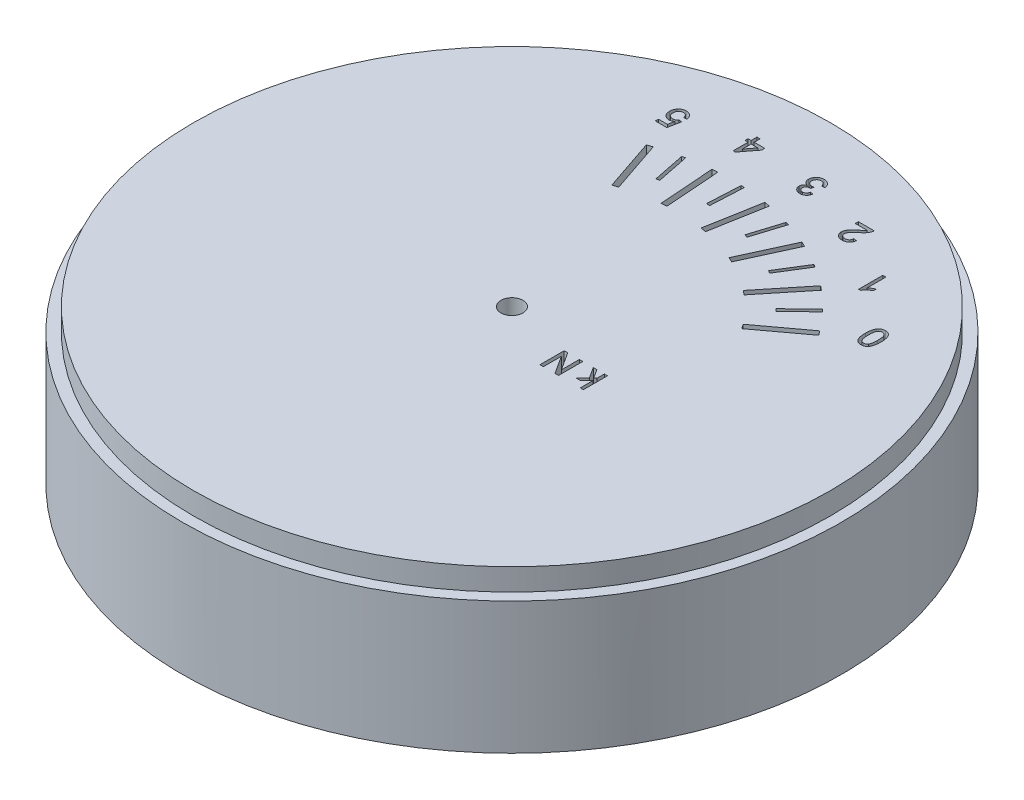
from build123d import *

# Parameters (mm, degrees)
SKETCH1_R           = 30
DIAL_CASE_DEPTH     = 12
SKETCH5_R           = 29
BEZEL_SPIGOT_DEPTH  = 2
SKETCH14_R          = 1
CUT_EXTRUDE8_DEPTH  = 14
SKETCH15_R          = 7.5
CUT_EXTRUDE9_DEPTH  = 6
CIRPATTERN1_COUNT   = 3
SKETCH20_W          = 7
SKETCH20_H          = 49.580398915
CUT_EXTRUDE11_DEPTH = 6
CUT_EXTRUDE27_DEPTH = 2


with BuildPart() as part:
    # Sketch1 → DIAL_CASE (new body)
    with BuildSketch(Plane(origin=(0, 0, 0), x_dir=(1, 0, 0), z_dir=(0, 1, 0))):
        with Locations(Location((0, 0, 0), (0, 0, 270))):
            Circle(SKETCH1_R)
    extrude(amount=DIAL_CASE_DEPTH)

    # Sketch5 → BEZEL_SPIGOT (add)
    with BuildSketch(Plane(origin=(0, 12, 0), x_dir=(1, 0, 0), z_dir=(0, 1, 0))):
        with Locations(Location((0, 0, 0), (0, 0, 270))):
            Circle(SKETCH5_R)
    extrude(amount=BEZEL_SPIGOT_DEPTH)

    # Sketch14 → Cut-Extrude8 (cut)
    with BuildSketch(Plane(origin=(0, 14, 0), x_dir=(1, 0, 0), z_dir=(0, 1, 0))):
        with Locations(Location((0, 0, 0), (0, 0, 270))):
            Circle(SKETCH14_R)
    extrude(amount=-CUT_EXTRUDE8_DEPTH, mode=Mode.SUBTRACT)

    # Sketch15 → Cut-Extrude9 (cut)
    with BuildSketch(Plane.XZ):
        with Locations(Location((0, 0, 0), (0, 0, 90))):
            Circle(SKETCH15_R)
    extrude(amount=-CUT_EXTRUDE9_DEPTH, mode=Mode.SUBTRACT)

    # Sketch19 → CSK for M3 SFHCS1 (revolve, cut)
    with BuildSketch(Plane(origin=(0, 0, 20), x_dir=(0, 0, -1), z_dir=(1, 0, 0))):
        Polygon((0, 0), (0, 7.021463052), (1.7, 6), (1.7, 1.66), (3.36, 0), align=None)
    csk_for_m3_sfhcs1 = revolve(axis=Axis((0, -6.35, 20), (0, 1, 0)), mode=Mode.SUBTRACT)

    # CirPattern1: CSK for M3 SFHCS1 ×3 about axis
    cirpattern1_axis = Axis((0, 0, 0), (0, 1, 0))
    for i in range(1, CIRPATTERN1_COUNT):
        add(csk_for_m3_sfhcs1.rotate(cirpattern1_axis, i * 360 / CIRPATTERN1_COUNT), mode=Mode.SUBTRACT)

    # Sketch20 → Cut-Extrude11 (cut)
    with BuildSketch(Plane(origin=(0, 0, 0), x_dir=(-1, 0, 0), z_dir=(0, -1, 0))):
        with Locations((-8.5, 4.790199458)):
            Rectangle(SKETCH20_W, SKETCH20_H)
    extrude(amount=-CUT_EXTRUDE11_DEPTH, mode=Mode.SUBTRACT)

    # Sketch43 → Cut-Extrude27 (cut)
    # profile 1 of 19: a face of its own
    with BuildSketch(Plane(origin=(0, 12, 0), x_dir=(1, 0, 0), z_dir=(0, 1, 0))):
        Polygon((11.904206737, 9.129751474), (12.201835663, 8.7279841), (16.219509396, 11.704273363), (15.92188047, 12.106040736), align=None)
    # profile 2 of 19: a face of its own
    with BuildSketch(Plane(origin=(0, 12, 0), x_dir=(1, 0, 0), z_dir=(0, 1, 0))):
        Polygon((9.254243085, 11.807687535), (9.642583551, 11.492740424), (12.792054657, 15.376145084), (12.403714191, 15.691092195), align=None)
    # profile 3 of 19: a face of its own
    with BuildSketch(Plane(origin=(0, 12, 0), x_dir=(1, 0, 0), z_dir=(0, 1, 0))):
        Polygon((6.020657208, 13.740967462), (6.47521838, 13.532702869), (8.557864311, 18.07831459), (8.103303139, 18.286579184), align=None)
    # profile 4 of 19: a face of its own
    with BuildSketch(Plane(origin=(0, 12, 0), x_dir=(1, 0, 0), z_dir=(0, 1, 0))):
        Polygon((2.407376381, 14.807668249), (2.899491193, 14.719220456), (3.783969122, 19.640368573), (3.29185431, 19.728816366), align=None)
    # profile 5 of 19: a face of its own
    with BuildSketch(Plane(origin=(0, 12, 0), x_dir=(1, 0, 0), z_dir=(0, 1, 0))):
        Polygon((-1.357726518, 14.94051802), (-0.859093467, 14.97746502), (-1.228563465, 19.963795526), (-1.727196515, 19.926848526), align=None)
    # profile 6 of 19: a face of its own
    with BuildSketch(Plane(origin=(0, 12, 0), x_dir=(1, 0, 0), z_dir=(0, 1, 0))):
        Polygon((-5.037203897, 14.131138556), (-4.563499083, 14.291150273), (-6.163616247, 19.028198411), (-6.637321061, 18.868186694), align=None)
    # profile 7 of 19: a face of its own
    with BuildSketch(Plane(origin=(0, 12, 0), x_dir=(1, 0, 0), z_dir=(0, 1, 0))):
        Polygon((12.177630557, 11.862875453), (12.385063097, 11.646145803), (14.552359596, 13.720471208), (14.344927056, 13.937200858), align=None)
    # profile 8 of 19: a face of its own
    with BuildSketch(Plane(origin=(0, 12, 0), x_dir=(1, 0, 0), z_dir=(0, 1, 0))):
        Polygon((8.838112877, 14.522749767), (9.093000675, 14.364534059), (10.675157753, 16.913412043), (10.420269955, 17.071627751), align=None)
    # profile 9 of 19: a face of its own
    with BuildSketch(Plane(origin=(0, 12, 0), x_dir=(1, 0, 0), z_dir=(0, 1, 0))):
        Polygon((4.941216374, 16.266741553), (5.227484838, 16.177017719), (6.12472318, 19.03970236), (5.838454716, 19.129426194), align=None)
    # profile 10 of 19: a face of its own
    with BuildSketch(Plane(origin=(0, 12, 0), x_dir=(1, 0, 0), z_dir=(0, 1, 0))):
        Polygon((0.732700253, 16.984865332), (1.032295758, 16.969291838), (1.1880307, 19.965246882), (0.888435195, 19.980820376), align=None)
    # profile 11 of 19: a face of its own
    with BuildSketch(Plane(origin=(0, 12, 0), x_dir=(1, 0, 0), z_dir=(0, 1, 0))):
        Polygon((-3.522023877, 16.631832365), (-3.227995432, 16.691391359), (-3.823585372, 19.631675805), (-4.117613816, 19.572116811), align=None)
    # profile 12 of 19: a face of its own
    with BuildSketch(Plane(origin=(0, 12, 0), x_dir=(1, 0, 0), z_dir=(0, 1, 0))):
        with BuildLine():
            add(Edge.make_bspline(
                [(19.588194751, 13.989440943), (19.587910508, 13.958000939), (19.587353794, 13.89642321), (19.583902691, 13.806323677), (19.577871681, 13.720760822), (19.568887763, 13.639804704), (19.558168373, 13.563144327), (19.544436382, 13.49098399), (19.528765941, 13.42324263), (19.510191242, 13.360177347), (19.489439178, 13.301133808), (19.466289506, 13.245945846), (19.439927647, 13.194895358), (19.412579294, 13.146767036), (19.381463663, 13.103407546), (19.348766206, 13.063242025), (19.313491266, 13.026968124), (19.275487559, 12.994761303), (19.235049694, 12.966327767), (19.192304993, 12.94165046), (19.146945317, 12.920631312), (19.098842724, 12.904164221), (19.048465422, 12.890910413), (18.995614062, 12.881112697), (18.940194422, 12.875348095), (18.902324297, 12.874757367), (18.883066546, 12.874456969)],
                knots=[0, 0, 0, 0, 1.514548985, 2.966363668, 4.342801279, 5.645536807, 6.88951609, 8.070636169, 9.18292944, 10.237633186, 11.23586543, 12.196673567, 13.117642805, 14.002448775, 14.860474521, 15.685016546, 16.495716207, 17.293997176, 18.081286888, 18.873901753, 19.668661895, 20.485546082, 21.319749152, 22.176139114, 23.072528574, 24, 24, 24, 24], degree=3))
            add(Edge.make_bspline(
                [(18.883066546, 12.874456969), (18.854809121, 12.875274628), (18.799296277, 12.876880952), (18.718349937, 12.890367128), (18.641827842, 12.9124468), (18.570310234, 12.943174302), (18.504739034, 12.982537638), (18.445935132, 13.029838471), (18.395318794, 13.085781836), (18.351889885, 13.149224706), (18.314616703, 13.22014777), (18.281284051, 13.297942796), (18.251395367, 13.382922338), (18.229518855, 13.458776472), (18.214181325, 13.524367131), (18.204843427, 13.578566772), (18.196221835, 13.636868938), (18.190110735, 13.699413261), (18.183892193, 13.765907419), (18.180822023, 13.836641357), (18.17847903, 13.911567043), (18.178121949, 13.962996348), (18.177938341, 13.989440943)],
                knots=[0, 0, 0, 0, 1.134392726, 2.228560011, 3.285421824, 4.326686528, 5.345663051, 6.348245061, 7.346442277, 8.364444627, 9.428234171, 10.559369172, 11.76117748, 13.044149777, 13.72830454, 14.465558531, 15.252424724, 16.094928615, 16.989169351, 17.934396366, 18.93788079, 20, 20, 20, 20], degree=3))
            add(Edge.make_bspline(
                [(18.177938341, 13.989440943), (18.178226252, 14.020733526), (18.178788741, 14.081869747), (18.182170352, 14.171243265), (18.188483548, 14.25617315), (18.196613619, 14.336764445), (18.207578689, 14.413086775), (18.221192935, 14.48483049), (18.237122696, 14.552166703), (18.255035112, 14.615365913), (18.275699736, 14.67456731), (18.299114958, 14.729695619), (18.324677105, 14.781177736), (18.35282256, 14.82875241), (18.383405925, 14.872576799), (18.415933253, 14.91294251), (18.451308912, 14.949288413), (18.489461309, 14.981430065), (18.529623749, 15.010388115), (18.572602896, 15.035159869), (18.618298941, 15.055825647), (18.666304423, 15.073097892), (18.71693803, 15.086224439), (18.769935925, 15.095970551), (18.825643873, 15.10179179), (18.863661568, 15.102367992), (18.883066546, 15.102662097)],
                knots=[0, 0, 0, 0, 1.508950488, 2.948031798, 4.311688408, 5.614950163, 6.853137481, 8.028455569, 9.134944892, 10.188708076, 11.194600246, 12.156350049, 13.075032267, 13.964295672, 14.819092354, 15.649926205, 16.461420415, 17.260483761, 18.05264124, 18.846032929, 19.648010917, 20.468054852, 21.303075505, 22.167271292, 23.064539283, 24, 24, 24, 24], degree=3))
            add(Edge.make_bspline(
                [(18.883066546, 15.102662097), (18.908508152, 15.101936374), (18.958112279, 15.100521414), (19.030555451, 15.09090763), (19.098547231, 15.073986918), (19.162661092, 15.051293858), (19.222176377, 15.020940583), (19.277377246, 14.984009897), (19.329372923, 14.941361032), (19.359304796, 14.907712056), (19.374452764, 14.890682931)],
                knots=[0, 0, 0, 0, 1.10322584, 2.150986741, 3.161425019, 4.136713905, 5.093944212, 6.049774532, 7.013026876, 8, 8, 8, 8], degree=3))
            add(Edge.make_bspline(
                [(19.374452764, 14.890682931), (19.391888424, 14.865531735), (19.427841502, 14.813668893), (19.469921461, 14.725237938), (19.507457531, 14.627887871), (19.536916463, 14.519708697), (19.55999015, 14.4015614), (19.576655113, 14.273214149), (19.586085842, 14.134722395), (19.587475912, 14.038961309), (19.588194751, 13.989440943)],
                knots=[0, 0, 0, 0, 0.779365345, 1.607084704, 2.489375761, 3.438383567, 4.461919411, 5.557722155, 6.737039282, 8, 8, 8, 8], degree=3))
        make_face()
        with BuildLine():
            add(Edge.make_bspline(
                [(19.306143469, 13.988559533), (19.305863415, 14.030873535), (19.305327329, 14.111871894), (19.299726529, 14.227592025), (19.290084982, 14.331987378), (19.277338227, 14.424913413), (19.260507351, 14.506495829), (19.239374194, 14.57652673), (19.2155521, 14.635846645), (19.18607271, 14.68372035), (19.153796035, 14.722744403), (19.120472573, 14.75630635), (19.085318339, 14.784833237), (19.04856271, 14.808618843), (19.009635397, 14.826627742), (18.968962062, 14.839680631), (18.926533856, 14.847192369), (18.897638319, 14.848271664), (18.883066546, 14.848815943)],
                knots=[0, 0, 0, 0, 1.89448813, 3.626469325, 5.185477471, 6.587276848, 7.82441448, 8.910550357, 9.859733512, 10.6775885, 11.416198291, 12.123144072, 12.791880183, 13.439617036, 14.078171869, 14.70637855, 15.347637704, 16, 16, 16, 16], degree=3))
            add(Edge.make_bspline(
                [(18.883066546, 14.848815943), (18.868498304, 14.848259915), (18.839609769, 14.84715732), (18.797085252, 14.839809134), (18.756563724, 14.826092107), (18.717718826, 14.808117251), (18.680523736, 14.784937521), (18.645851192, 14.755780037), (18.612154223, 14.722319983), (18.580221687, 14.682850203), (18.550547709, 14.634993504), (18.526770618, 14.575635913), (18.505618407, 14.505617973), (18.488842574, 14.424171247), (18.476005164, 14.331406135), (18.466433931, 14.227295907), (18.460791966, 14.111726025), (18.460265271, 14.030873831), (18.459989623, 13.988559533)],
                knots=[0, 0, 0, 0, 0.652578524, 1.294050225, 1.924494109, 2.563260593, 3.207694917, 3.880813851, 4.587993952, 5.331957758, 6.150083828, 7.099581593, 8.186077474, 9.42362516, 10.819375359, 12.378900244, 14.104883934, 16, 16, 16, 16], degree=3))
            add(Edge.make_bspline(
                [(18.459989623, 13.988559533), (18.460256717, 13.947125758), (18.46076846, 13.867740214), (18.466552205, 13.754249479), (18.475615638, 13.651606212), (18.488013642, 13.559716592), (18.504488492, 13.47867782), (18.524476574, 13.408325348), (18.548275961, 13.348784655), (18.576633103, 13.299533489), (18.608074588, 13.25887828), (18.641480362, 13.224373932), (18.67620395, 13.194136614), (18.714229663, 13.170460171), (18.753940969, 13.151042072), (18.796189153, 13.138042966), (18.840428702, 13.129700239), (18.870687639, 13.12877564), (18.886151482, 13.128303123)],
                knots=[0, 0, 0, 0, 1.850145643, 3.544809038, 5.072983816, 6.450691362, 7.683229814, 8.76276662, 9.712991103, 10.538891656, 11.292051756, 12.001912283, 12.681449089, 13.342071824, 13.996410874, 14.649960216, 15.310061595, 16, 16, 16, 16], degree=3))
            add(Edge.make_bspline(
                [(18.886151482, 13.128303123), (18.900724217, 13.128681569), (18.929459782, 13.129427816), (18.971500063, 13.136682818), (19.011522536, 13.14852633), (19.049260849, 13.165610934), (19.085088552, 13.186806065), (19.11904912, 13.212585719), (19.150328311, 13.243743208), (19.169153032, 13.267086763), (19.178779687, 13.279024277)],
                knots=[0, 0, 0, 0, 1.021462953, 2.014194051, 2.982449609, 3.941891643, 4.91211921, 5.897280499, 6.924703483, 8, 8, 8, 8], degree=3))
            add(Edge.make_bspline(
                [(19.178779687, 13.279024277), (19.189263134, 13.296550691), (19.211401967, 13.333562788), (19.236164806, 13.397893332), (19.258124512, 13.471539124), (19.275960128, 13.555408639), (19.289157683, 13.649386697), (19.299379117, 13.753323416), (19.304740126, 13.867603448), (19.305662782, 13.947128433), (19.306143469, 13.988559533)],
                knots=[0, 0, 0, 0, 0.671109831, 1.417242661, 2.260125669, 3.199948126, 4.23589883, 5.382398214, 6.636276086, 8, 8, 8, 8], degree=3))
        make_face(mode=Mode.SUBTRACT)
    # profile 13 of 19: a face of its own
    with BuildSketch(Plane(origin=(0, 12, 0), x_dir=(1, 0, 0), z_dir=(0, 1, 0))):
        with BuildLine():
            Line((14.407642404, 19.352001901), (14.689693686, 19.352001901))
            Line((14.689693686, 19.352001901), (14.689693686, 17.637658953))
            add(Edge.make_bspline(
                [(14.689693686, 17.637658953), (14.705939906, 17.653313064), (14.739705895, 17.68584842), (14.79659993, 17.731996926), (14.860522228, 17.778000197), (14.929704418, 17.823324057), (15.000555464, 17.865721374), (15.069185162, 17.90381391), (15.134102796, 17.935987754), (15.176866065, 17.953577499), (15.197385993, 17.962017927)],
                knots=[0, 0, 0, 0, 0.893397159, 1.856828087, 2.898636849, 4.012322965, 5.13208925, 6.168716716, 7.121259871, 8, 8, 8, 8], degree=3))
            Line((15.197385993, 17.962017927), (15.197385993, 17.702001901))
            add(Edge.make_bspline(
                [(15.197385993, 17.702001901), (15.162148049, 17.68384139), (15.092696146, 17.648048099), (14.994382794, 17.586347454), (14.903061577, 17.518812635), (14.819275234, 17.446755065), (14.744555984, 17.372946524), (14.681096324, 17.298936225), (14.628414659, 17.226583843), (14.601893545, 17.176127), (14.589212916, 17.152001901)],
                knots=[0, 0, 0, 0, 1.141359047, 2.249551097, 3.338622382, 4.409719606, 5.42990334, 6.36011437, 7.215916014, 8, 8, 8, 8], degree=3))
            Line((14.589212916, 17.152001901), (14.407642404, 17.152001901))
            Line((14.407642404, 17.152001901), (14.407642404, 19.352001901))
        make_face()
    # profile 14 of 19: a face of its own
    with BuildSketch(Plane(origin=(0, 12, 0), x_dir=(1, 0, 0), z_dir=(0, 1, 0))):
        with BuildLine():
            Line((9.069146677, 22.18232381), (9.069146677, 22.464375092))
            Line((9.069146677, 22.464375092), (10.507608216, 22.464375092))
            add(Edge.make_bspline(
                [(10.507608216, 22.464375092), (10.507647327, 22.447610791), (10.507725077, 22.414284583), (10.501944288, 22.364802772), (10.493232714, 22.3159316), (10.483141353, 22.284475757), (10.478080972, 22.268702015)],
                knots=[0, 0, 0, 0, 1.010600758, 2.009000657, 3.001600101, 4, 4, 4, 4], degree=3))
            add(Edge.make_bspline(
                [(10.478080972, 22.268702015), (10.468764001, 22.242919337), (10.449837831, 22.19054531), (10.411061099, 22.114872022), (10.365575116, 22.039655585), (10.321460015, 21.978136377), (10.281008362, 21.929368822), (10.247635052, 21.890762576), (10.210045364, 21.851737132), (10.168919058, 21.811599859), (10.124507327, 21.770347497), (10.076811432, 21.727788083), (10.02525019, 21.684730468), (9.989255791, 21.656189463), (9.97082937, 21.641578618)],
                knots=[0, 0, 0, 0, 1.204775845, 2.447339333, 3.731688634, 5.069474332, 5.771881205, 6.518320379, 7.313534551, 8.154278236, 9.045805008, 9.979490009, 10.965651065, 12, 12, 12, 12], degree=3))
            add(Edge.make_bspline(
                [(9.97082937, 21.641578618), (9.942521739, 21.617752541), (9.888013602, 21.571873919), (9.811039527, 21.503794322), (9.74073639, 21.44057847), (9.678223032, 21.381118767), (9.62299029, 21.325990677), (9.574901696, 21.27532311), (9.533564773, 21.229261612), (9.499418266, 21.186178312), (9.470834286, 21.145504419), (9.446017142, 21.106049247), (9.42609474, 21.066431241), (9.408998325, 21.027402779), (9.395734769, 20.988809733), (9.386400228, 20.950306425), (9.380368261, 20.912257335), (9.379721233, 20.88681906), (9.379403088, 20.87431099)],
                knots=[0, 0, 0, 0, 1.782511555, 3.432339066, 4.950556168, 6.337242158, 7.588364383, 8.709771971, 9.70247892, 10.569050646, 11.3564271, 12.096888545, 12.812232926, 13.490631961, 14.148641375, 14.7751826, 15.397753892, 16, 16, 16, 16], degree=3))
            add(Edge.make_bspline(
                [(9.379403088, 20.87431099), (9.379709292, 20.861946817), (9.380310047, 20.837688984), (9.38601117, 20.802188289), (9.393944993, 20.767998371), (9.40678154, 20.735743649), (9.422026655, 20.70443543), (9.441779363, 20.675093893), (9.464137809, 20.646609884), (9.490257881, 20.620475219), (9.518588325, 20.595981723), (9.5501215, 20.575514129), (9.583374975, 20.557653394), (9.618637454, 20.543095441), (9.65617424, 20.532021338), (9.695721462, 20.524263833), (9.737423346, 20.519259909), (9.765886861, 20.518572716), (9.780444754, 20.518221246)],
                knots=[0, 0, 0, 0, 0.987999173, 1.938400644, 2.870175051, 3.788745887, 4.708217872, 5.649938364, 6.61138593, 7.600013579, 8.600369295, 9.600725011, 10.599354487, 11.616065131, 12.645726306, 13.724038792, 14.835941382, 16, 16, 16, 16], degree=3))
            add(Edge.make_bspline(
                [(9.780444754, 20.518221246), (9.795736554, 20.51857333), (9.82566373, 20.519262385), (9.869416239, 20.524253075), (9.910925402, 20.531941565), (9.950082087, 20.543432939), (9.986606304, 20.558674728), (10.021328511, 20.576045194), (10.053326805, 20.597502787), (10.082638515, 20.622239739), (10.109769776, 20.649241048), (10.132673679, 20.679765469), (10.152849351, 20.712289408), (10.168419625, 20.747935104), (10.181438381, 20.785588394), (10.190718445, 20.825895408), (10.19581034, 20.868746965), (10.196830526, 20.898096468), (10.197351806, 20.913093041)],
                knots=[0, 0, 0, 0, 1.131007971, 2.213465715, 3.25352735, 4.250693176, 5.225400803, 6.177988609, 7.118348849, 8.067272485, 9.012455277, 9.942714685, 10.883890855, 11.837222194, 12.81320114, 13.828092093, 14.890230783, 16, 16, 16, 16], degree=3))
            Line((10.197351806, 20.913093041), (10.479403088, 20.884887913))
            add(Edge.make_bspline(
                [(10.479403088, 20.884887913), (10.47651765, 20.860306203), (10.470904279, 20.812484603), (10.456915662, 20.74322724), (10.437300665, 20.678782518), (10.413749236, 20.618323563), (10.384477391, 20.562554522), (10.350348328, 20.511305246), (10.312017937, 20.463987695), (10.268084683, 20.422341037), (10.220256116, 20.384898525), (10.168058841, 20.352894402), (10.112070574, 20.325258834), (10.052118808, 20.302877236), (9.988186096, 20.285737478), (9.920383481, 20.273479887), (9.848630979, 20.265915686), (9.799413894, 20.264895951), (9.774274883, 20.264375092)],
                knots=[0, 0, 0, 0, 1.130828508, 2.199929528, 3.223633236, 4.205997909, 5.160910297, 6.095620583, 7.016241394, 7.937376102, 8.855913919, 9.787436367, 10.73018861, 11.705300542, 12.706861604, 13.751074331, 14.851297925, 16, 16, 16, 16], degree=3))
            add(Edge.make_bspline(
                [(9.774274883, 20.264375092), (9.748835154, 20.26481087), (9.699278412, 20.265659766), (9.627064942, 20.274340638), (9.558934515, 20.287871596), (9.494614455, 20.30669332), (9.434446425, 20.331550879), (9.378224655, 20.361489617), (9.326126319, 20.397023801), (9.278861796, 20.43799941), (9.236230306, 20.482747294), (9.198956625, 20.530540632), (9.167436117, 20.581035946), (9.141860909, 20.634121655), (9.121673882, 20.689751383), (9.107980345, 20.748050218), (9.098519486, 20.808926182), (9.097746207, 20.850475198), (9.097351806, 20.871666759)],
                knots=[0, 0, 0, 0, 1.195184963, 2.328227347, 3.412838735, 4.457075639, 5.472567195, 6.467212925, 7.445817268, 8.429862391, 9.40172103, 10.346392722, 11.273671097, 12.19390528, 13.111181922, 14.048965502, 15.00489906, 16, 16, 16, 16], degree=3))
            add(Edge.make_bspline(
                [(9.097351806, 20.871666759), (9.097945171, 20.893440713), (9.099133212, 20.937036672), (9.108800708, 21.002107571), (9.124208796, 21.066572489), (9.146063045, 21.131024071), (9.17568813, 21.195806958), (9.212802227, 21.262105533), (9.25875676, 21.329464773), (9.30280318, 21.386799511), (9.343861009, 21.434800186), (9.38055837, 21.47439698), (9.422494166, 21.517106458), (9.469534062, 21.56278672), (9.521902634, 21.611336944), (9.578921042, 21.663363717), (9.64166078, 21.717824673), (9.685225486, 21.755018668), (9.707728408, 21.774230861)],
                knots=[0, 0, 0, 0, 0.92705835, 1.85616256, 2.795554264, 3.747284035, 4.749796966, 5.825476635, 6.979499781, 8.219726678, 8.903135141, 9.669166345, 10.518679137, 11.452302006, 12.461664484, 13.560176038, 14.739732795, 16, 16, 16, 16], degree=3))
            add(Edge.make_bspline(
                [(9.707728408, 21.774230861), (9.727035994, 21.789872751), (9.763925736, 21.819758688), (9.815707872, 21.863715169), (9.863020424, 21.902896822), (9.905217946, 21.93793332), (9.942069831, 21.969236326), (9.973086822, 21.997184948), (9.999693603, 22.020343592), (10.039465116, 22.056784967), (10.09005708, 22.108349747), (10.127476529, 22.158412915), (10.1453486, 22.18232381)],
                knots=[0, 0, 0, 0, 1.242120814, 2.373239094, 3.395283395, 4.312960318, 5.115054069, 5.812109485, 6.400004863, 6.878180934, 8.508973911, 10, 10, 10, 10], degree=3))
            Line((10.1453486, 22.18232381), (9.069146677, 22.18232381))
        make_face()
    # profile 15 of 19: a face of its own
    with BuildSketch(Plane(origin=(0, 12, 0), x_dir=(1, 0, 0), z_dir=(0, 1, 0))):
        with BuildLine():
            Line((4.862174471, 23.622985895), (4.580123189, 23.594780767))
            add(Edge.make_bspline(
                [(4.580123189, 23.594780767), (4.576355607, 23.611724634), (4.569065614, 23.64450976), (4.555168479, 23.691534138), (4.540003174, 23.735047982), (4.522861032, 23.774866552), (4.50383016, 23.810818425), (4.483123051, 23.843173045), (4.46059436, 23.871994043), (4.436299391, 23.897350285), (4.409836966, 23.919149366), (4.381634737, 23.938323911), (4.350981772, 23.953936754), (4.318641524, 23.967721985), (4.283628483, 23.976776464), (4.246947481, 23.984636205), (4.207979911, 23.989013434), (4.181294947, 23.989436043), (4.167623189, 23.989652562)],
                knots=[0, 0, 0, 0, 1.320863373, 2.55577264, 3.729906283, 4.826684068, 5.852115289, 6.822930572, 7.746759761, 8.632447832, 9.490020731, 10.352173977, 11.222410537, 12.104916612, 13.021885673, 13.969235249, 14.959559309, 16, 16, 16, 16], degree=3))
            add(Edge.make_bspline(
                [(4.167623189, 23.989652562), (4.151585976, 23.989419167), (4.120265272, 23.988963348), (4.074596591, 23.982328435), (4.03129197, 23.9729004), (3.990350009, 23.95932318), (3.952339672, 23.940877436), (3.916315338, 23.919270642), (3.882699337, 23.893624423), (3.851946749, 23.864081673), (3.824453015, 23.831561851), (3.799963788, 23.797218283), (3.779715032, 23.76075107), (3.762648234, 23.722675658), (3.75005074, 23.682376289), (3.740828349, 23.640355605), (3.734801471, 23.596423535), (3.734250526, 23.566448923), (3.733969343, 23.551150959)],
                knots=[0, 0, 0, 0, 1.111305623, 2.170381722, 3.19371552, 4.182850272, 5.153552327, 6.118085682, 7.092150549, 8.07939443, 9.069578106, 10.041989709, 10.999935456, 11.957881203, 12.930986452, 13.922270303, 14.939601495, 16, 16, 16, 16], degree=3))
            add(Edge.make_bspline(
                [(3.733969343, 23.551150959), (3.734233201, 23.536582276), (3.73474977, 23.508060426), (3.741003761, 23.466413413), (3.749348186, 23.426542797), (3.762481185, 23.388859947), (3.778695997, 23.352818515), (3.799146243, 23.31906504), (3.822635825, 23.286818085), (3.849944292, 23.25727226), (3.879546001, 23.229839184), (3.912007272, 23.206542414), (3.946151751, 23.186426298), (3.982407023, 23.170185902), (4.020617074, 23.157295119), (4.060746963, 23.148030435), (4.102989219, 23.142713016), (4.131764134, 23.142066363), (4.146469343, 23.141735895)],
                knots=[0, 0, 0, 0, 1.072945096, 2.100558977, 3.098942871, 4.071504682, 5.035832505, 6.007127449, 6.975278252, 7.971781063, 8.968283874, 9.945176759, 10.910962739, 11.885150959, 12.867967907, 13.879305485, 14.91623465, 16, 16, 16, 16], degree=3))
            add(Edge.make_bspline(
                [(4.146469343, 23.141735895), (4.159415206, 23.142087378), (4.187035042, 23.142837263), (4.230423072, 23.149138049), (4.278430184, 23.158306218), (4.311489574, 23.167078408), (4.328921266, 23.171703844)],
                knots=[0, 0, 0, 0, 0.83759105, 1.78699, 2.83311496, 4, 4, 4, 4], degree=3))
            Line((4.328921266, 23.171703844), (4.299834728, 22.91785769))
            add(Edge.make_bspline(
                [(4.299834728, 22.91785769), (4.2922031, 22.918691618), (4.278720642, 22.920164883), (4.265170192, 22.920707258), (4.259289856, 22.920942626)],
                knots=[0, 0, 0, 0, 1.132082448, 2, 2, 2, 2], degree=3))
            add(Edge.make_bspline(
                [(4.259289856, 22.920942626), (4.23351042, 22.919908484), (4.182654442, 22.917868396), (4.108391066, 22.902208773), (4.038432684, 22.87554074), (3.983594067, 22.846169525), (3.944027614, 22.816788852), (3.917572914, 22.792226287), (3.896046613, 22.76389959), (3.87758536, 22.733525308), (3.864071243, 22.699786988), (3.853740586, 22.663657955), (3.848220504, 22.62451426), (3.847275646, 22.597627018), (3.846789856, 22.583803203)],
                knots=[0, 0, 0, 0, 1.549727635, 3.057200923, 4.538980323, 6.041552596, 6.78014733, 7.498816896, 8.203945614, 8.913048163, 9.630032305, 10.382447444, 11.168351028, 12, 12, 12, 12], degree=3))
            add(Edge.make_bspline(
                [(3.846789856, 22.583803203), (3.846998031, 22.57262359), (3.847405162, 22.550759421), (3.851949644, 22.518705706), (3.859447236, 22.488328234), (3.869687902, 22.459203664), (3.882864794, 22.431596511), (3.898905207, 22.405271932), (3.9178686, 22.380505607), (3.93991004, 22.357787576), (3.964064374, 22.337056554), (3.990224734, 22.318955638), (4.017998649, 22.303282448), (4.047805604, 22.2913298), (4.078643618, 22.280589312), (4.111637658, 22.274577407), (4.146029935, 22.269678108), (4.169659686, 22.269321723), (4.181725753, 22.269139741)],
                knots=[0, 0, 0, 0, 1.040874226, 2.035656362, 3.008162301, 3.951736728, 4.906655565, 5.852509758, 6.818736726, 7.805959617, 8.796023989, 9.779255012, 10.765528925, 11.759275074, 12.767613909, 13.800903593, 14.877074665, 16, 16, 16, 16], degree=3))
            add(Edge.make_bspline(
                [(4.181725753, 22.269139741), (4.205330611, 22.270060134), (4.25091509, 22.271837548), (4.316179107, 22.288282314), (4.37532009, 22.314892086), (4.419105223, 22.34609792), (4.450196517, 22.375932462), (4.471433518, 22.401220677), (4.490428812, 22.429146241), (4.507236235, 22.4596992), (4.521628714, 22.493002427), (4.534603134, 22.528643345), (4.544646539, 22.567192565), (4.549453132, 22.593903374), (4.551918061, 22.60760128)],
                knots=[0, 0, 0, 0, 1.533565899, 2.961543033, 4.347411787, 5.731829577, 6.434842101, 7.147085226, 7.87612511, 8.629021686, 9.412189982, 10.234506416, 11.094615066, 12, 12, 12, 12], degree=3))
            Line((4.551918061, 22.60760128), (4.833969343, 22.579396152))
            add(Edge.make_bspline(
                [(4.833969343, 22.579396152), (4.82955723, 22.557587629), (4.820902521, 22.514808495), (4.803269875, 22.453023948), (4.781767783, 22.395025179), (4.755948417, 22.341081209), (4.727042414, 22.290535301), (4.693665229, 22.244027184), (4.656674154, 22.2010519), (4.615517564, 22.162385117), (4.571652616, 22.127628811), (4.525037277, 22.097201425), (4.47548646, 22.072308967), (4.423510541, 22.051321179), (4.36892445, 22.035040304), (4.311660918, 22.02375372), (4.251991216, 22.016370722), (4.211275637, 22.015657049), (4.190539856, 22.015293588)],
                knots=[0, 0, 0, 0, 1.136675342, 2.229678162, 3.279607278, 4.293661059, 5.282505831, 6.25114153, 7.214380889, 8.175511859, 9.132176529, 10.071243677, 11.014621516, 11.96113019, 12.932525334, 13.920372324, 14.940879554, 16, 16, 16, 16], degree=3))
            add(Edge.make_bspline(
                [(4.190539856, 22.015293588), (4.16183049, 22.016208421), (4.105378595, 22.018007279), (4.022441677, 22.032790418), (3.942820561, 22.055831626), (3.867645903, 22.088902879), (3.798698273, 22.130124006), (3.737063539, 22.178286837), (3.684600117, 22.233933383), (3.641302809, 22.295816047), (3.607780588, 22.362258757), (3.582517083, 22.431039543), (3.56754487, 22.502215447), (3.565675908, 22.550388377), (3.564738574, 22.574548395)],
                knots=[0, 0, 0, 0, 1.104443116, 2.171692241, 3.232766296, 4.288659302, 5.323429713, 6.317858538, 7.289912208, 8.256274599, 9.214762562, 10.146710664, 11.070525645, 12, 12, 12, 12], degree=3))
            add(Edge.make_bspline(
                [(3.564738574, 22.574548395), (3.565686869, 22.597387812), (3.567559231, 22.642483147), (3.581974207, 22.708420516), (3.60633265, 22.770888757), (3.639256119, 22.830107046), (3.68194978, 22.884794737), (3.734296366, 22.933526455), (3.79545847, 22.976768488), (3.841294294, 22.999275488), (3.864858766, 23.010846472)],
                knots=[0, 0, 0, 0, 0.975609618, 1.926294443, 2.868398979, 3.832526731, 4.812148358, 5.820404151, 6.879456693, 8, 8, 8, 8], degree=3))
            add(Edge.make_bspline(
                [(3.864858766, 23.010846472), (3.849052488, 23.014819041), (3.818092602, 23.022600143), (3.773816945, 23.038996583), (3.731615096, 23.057108517), (3.692537226, 23.079477637), (3.655438544, 23.10401593), (3.62170311, 23.132627678), (3.589668454, 23.163242071), (3.56109781, 23.197377314), (3.535411302, 23.234079866), (3.513053836, 23.273197515), (3.493933804, 23.314445876), (3.478425423, 23.357952063), (3.466633566, 23.403700483), (3.45837142, 23.451760069), (3.452872232, 23.501811791), (3.452239235, 23.536005193), (3.451918061, 23.553354485)],
                knots=[0, 0, 0, 0, 1.052871401, 2.06226775, 3.04875161, 4.018265612, 4.969180349, 5.920095087, 6.873803922, 7.830817209, 8.792484547, 9.76668547, 10.739774713, 11.728085566, 12.748546436, 13.790004843, 14.878676886, 16, 16, 16, 16], degree=3))
            add(Edge.make_bspline(
                [(3.451918061, 23.553354485), (3.452454946, 23.577039928), (3.453510098, 23.623589423), (3.46351074, 23.691972449), (3.479859179, 23.757489652), (3.502465166, 23.820377369), (3.531089323, 23.880657627), (3.56673044, 23.937882222), (3.60890447, 23.992132669), (3.656630668, 24.043551382), (3.70956888, 24.090209005), (3.766122925, 24.13166896), (3.826541973, 24.166150196), (3.890209262, 24.194405144), (3.957221578, 24.216558991), (4.027593963, 24.23245102), (4.101558325, 24.241788177), (4.152024775, 24.242921032), (4.177759407, 24.243498716)],
                knots=[0, 0, 0, 0, 1.01607258, 1.996908675, 2.95877549, 3.910086634, 4.860477989, 5.817538548, 6.797442, 7.805659243, 8.824076609, 9.821650804, 10.810157683, 11.803718845, 12.806618772, 13.834497161, 14.895733332, 16, 16, 16, 16], degree=3))
            add(Edge.make_bspline(
                [(4.177759407, 24.243498716), (4.200844089, 24.242996031), (4.246272116, 24.242006804), (4.312980481, 24.234050187), (4.376674636, 24.220335449), (4.437352137, 24.201394058), (4.494906128, 24.177033554), (4.549549426, 24.147463772), (4.600796125, 24.111783101), (4.649151814, 24.071488923), (4.693209761, 24.026758031), (4.733208913, 23.978934914), (4.766685383, 23.92697634), (4.796807097, 23.872676608), (4.820840361, 23.814797654), (4.839934835, 23.753727786), (4.854070962, 23.689562094), (4.859449755, 23.645371412), (4.862174471, 23.622985895)],
                knots=[0, 0, 0, 0, 1.084576807, 2.134323748, 3.151142605, 4.142355663, 5.116768311, 6.08364505, 7.056369045, 8.046283224, 9.037183744, 10.003246936, 10.970123675, 11.937000414, 12.917774273, 13.908987331, 14.940763117, 16, 16, 16, 16], degree=3))
        make_face()
    # profile 16 of 19: a face of its own
    with BuildSketch(Plane(origin=(0, 12, 0), x_dir=(1, 0, 0), z_dir=(0, 1, 0))):
        Polygon((-1.933944886, 24.521650817), (-1.933944886, 23.985753381), (-0.974970527, 23.985753381), (-0.974970527, 23.703702099), (-2.01856027, 22.349855945), (-2.215996168, 22.349855945), (-2.215996168, 23.703702099), (-2.49804745, 23.703702099), (-2.49804745, 23.985753381), (-2.215996168, 23.985753381), (-2.215996168, 24.521650817), align=None)
        Polygon((-1.933944886, 23.703702099), (-1.933944886, 22.911314278), (-1.323127578, 23.703702099), align=None, mode=Mode.SUBTRACT)
    # profile 17 of 19: a face of its own
    with BuildSketch(Plane(origin=(0, 12, 0), x_dir=(1, 0, 0), z_dir=(0, 1, 0))):
        with BuildLine():
            Line((-6.815422463, 22.743613429), (-7.097473745, 22.715408301))
            add(Edge.make_bspline(
                [(-7.097473745, 22.715408301), (-7.100266496, 22.731300342), (-7.10569883, 22.762212835), (-7.116050743, 22.806959586), (-7.129494931, 22.848530567), (-7.144600956, 22.887285809), (-7.162557016, 22.922815523), (-7.182012556, 22.955680703), (-7.204956388, 22.98471474), (-7.229078748, 23.01143614), (-7.255554881, 23.034982419), (-7.284640262, 23.054832745), (-7.315523389, 23.072150952), (-7.348580409, 23.08633033), (-7.383861984, 23.096708889), (-7.420919075, 23.104916547), (-7.460228857, 23.109052347), (-7.487049654, 23.109865613), (-7.500718937, 23.110280096)],
                knots=[0, 0, 0, 0, 1.237781394, 2.407677316, 3.51963579, 4.58689595, 5.594855907, 6.570874, 7.510833816, 8.428091223, 9.330271693, 10.221190844, 11.124215526, 12.043132878, 12.973586933, 13.941700858, 14.950982896, 16, 16, 16, 16], degree=3))
            add(Edge.make_bspline(
                [(-7.500718937, 23.110280096), (-7.517486285, 23.109870261), (-7.550275564, 23.109068812), (-7.598008007, 23.102432064), (-7.642933311, 23.091162384), (-7.685477893, 23.076534261), (-7.724962013, 23.056506614), (-7.761268676, 23.031780752), (-7.79567917, 23.003732268), (-7.826193064, 22.970377847), (-7.853960401, 22.934044244), (-7.87792803, 22.894390528), (-7.898104766, 22.851966222), (-7.915091544, 22.806781383), (-7.927634996, 22.758577354), (-7.936861731, 22.707610719), (-7.942784923, 22.653848971), (-7.943342719, 22.61699995), (-7.943627591, 22.598180737)],
                knots=[0, 0, 0, 0, 1.052750423, 2.05869932, 3.018624241, 3.958205853, 4.878289862, 5.789216265, 6.712947111, 7.659433357, 8.620775926, 9.5811884, 10.56329027, 11.567503128, 12.60809625, 13.686605721, 14.818523251, 16, 16, 16, 16], degree=3))
            add(Edge.make_bspline(
                [(-7.943627591, 22.598180737), (-7.94330381, 22.580246271), (-7.942673332, 22.545323707), (-7.937363681, 22.494470648), (-7.928405675, 22.446653382), (-7.916814854, 22.401344881), (-7.900838368, 22.359253145), (-7.881889357, 22.319767886), (-7.858676023, 22.283727096), (-7.832849656, 22.250008597), (-7.803352684, 22.21978132), (-7.769786609, 22.194258214), (-7.733468207, 22.171920342), (-7.693665989, 22.153805721), (-7.650356517, 22.140347239), (-7.603970169, 22.129992147), (-7.554025616, 22.124545793), (-7.519680542, 22.123590991), (-7.502041053, 22.123100608)],
                knots=[0, 0, 0, 0, 1.165854935, 2.270189951, 3.319242023, 4.32700288, 5.306253956, 6.24172124, 7.169108591, 8.088047231, 8.999810445, 9.905349262, 10.822648491, 11.767237767, 12.739852311, 13.766490849, 14.852878837, 16, 16, 16, 16], degree=3))
            add(Edge.make_bspline(
                [(-7.502041053, 22.123100608), (-7.480112389, 22.123762579), (-7.437913287, 22.125036462), (-7.377400203, 22.135147092), (-7.322588002, 22.152257564), (-7.27350031, 22.176450251), (-7.229696289, 22.206296381), (-7.190527703, 22.240442052), (-7.15489969, 22.27798936), (-7.135457197, 22.306298719), (-7.125678873, 22.320536506)],
                knots=[0, 0, 0, 0, 1.182595606, 2.275764447, 3.298426239, 4.269611407, 5.217028086, 6.149744883, 7.069440711, 8, 8, 8, 8], degree=3))
            Line((-7.125678873, 22.320536506), (-6.843627591, 22.292331378))
            Line((-6.843627591, 22.292331378), (-7.069268617, 21.164126249))
            Line((-7.069268617, 21.164126249), (-8.11285836, 21.164126249))
            Line((-8.11285836, 21.164126249), (-8.11285836, 21.446177531))
            Line((-8.11285836, 21.446177531), (-7.299757399, 21.446177531))
            Line((-7.299757399, 21.446177531), (-7.187377591, 22.016009262))
            add(Edge.make_bspline(
                [(-7.187377591, 22.016009262), (-7.202941125, 22.00433242), (-7.233505444, 21.981400949), (-7.281168259, 21.951346334), (-7.329438465, 21.926183769), (-7.378062208, 21.905121507), (-7.427713574, 21.889271693), (-7.477851611, 21.877937794), (-7.528548528, 21.870377085), (-7.562537752, 21.869629732), (-7.579605155, 21.869254454)],
                knots=[0, 0, 0, 0, 1.093799738, 2.148049664, 3.164132611, 4.152263193, 5.124065093, 6.089950765, 7.040884846, 8, 8, 8, 8], degree=3))
            add(Edge.make_bspline(
                [(-7.579605155, 21.869254454), (-7.601817787, 21.8698366), (-7.645559846, 21.870982987), (-7.710016886, 21.880397264), (-7.771642451, 21.896390638), (-7.830949229, 21.917890126), (-7.886976021, 21.946508182), (-7.940879894, 21.98064485), (-7.991964378, 22.021294692), (-8.039701686, 22.067869806), (-8.083358338, 22.119193524), (-8.121166675, 22.17490196), (-8.153742428, 22.233960976), (-8.18013191, 22.296595543), (-8.200517325, 22.362911944), (-8.214833913, 22.432570146), (-8.223934925, 22.505834474), (-8.225088594, 22.555845556), (-8.225678873, 22.581433942)],
                knots=[0, 0, 0, 0, 0.991597857, 1.952696668, 2.900949301, 3.830734109, 4.763637652, 5.704464329, 6.67567345, 7.673047844, 8.678436512, 9.679149028, 10.67438547, 11.685620835, 12.708554508, 13.767372585, 14.857666581, 16, 16, 16, 16], degree=3))
            add(Edge.make_bspline(
                [(-8.225678873, 22.581433942), (-8.225184098, 22.605841811), (-8.224206776, 22.654054317), (-8.216055934, 22.725080468), (-8.202975719, 22.793650438), (-8.184261205, 22.859447168), (-8.161037081, 22.92305263), (-8.13161274, 22.983682401), (-8.097971676, 23.042540211), (-8.070936216, 23.078806465), (-8.057329514, 23.097058942)],
                knots=[0, 0, 0, 0, 1.059762356, 2.093333049, 3.100576568, 4.08823236, 5.061210495, 6.037154334, 7.012117566, 8, 8, 8, 8], degree=3))
            add(Edge.make_bspline(
                [(-8.057329514, 23.097058942), (-8.040045751, 23.118363078), (-8.006046732, 23.1602706), (-7.947214537, 23.214730639), (-7.883769714, 23.260800025), (-7.816083719, 23.299130427), (-7.743310024, 23.328509806), (-7.665832148, 23.348805095), (-7.583889706, 23.362232842), (-7.527656856, 23.36348643), (-7.498956117, 23.364126249)],
                knots=[0, 0, 0, 0, 1.023063757, 2.01247625, 2.982117532, 3.944599247, 4.908953799, 5.902627458, 6.929519989, 8, 8, 8, 8], degree=3))
            add(Edge.make_bspline(
                [(-7.498956117, 23.364126249), (-7.475281586, 23.363644688), (-7.428969451, 23.362702658), (-7.361150082, 23.354553902), (-7.296684319, 23.341463552), (-7.235319606, 23.32300502), (-7.177638808, 23.298533799), (-7.122833616, 23.269567831), (-7.072133919, 23.234272406), (-7.024518409, 23.194738198), (-6.980971657, 23.150880246), (-6.942385638, 23.102947858), (-6.908893724, 23.051427967), (-6.879373938, 22.996880599), (-6.856424277, 22.938187601), (-6.837201252, 22.876564595), (-6.822949008, 22.811392786), (-6.817957617, 22.766443442), (-6.815422463, 22.743613429)],
                knots=[0, 0, 0, 0, 1.109091339, 2.169605288, 3.195665858, 4.188679546, 5.166738875, 6.127665597, 7.0881237, 8.055905583, 9.024592931, 9.979285586, 10.933953421, 11.900951517, 12.880148814, 13.881763063, 14.92413606, 16, 16, 16, 16], degree=3))
        make_face()
    # profile 18 of 19: a face of its own
    with BuildSketch(Plane(origin=(0, 12, 0), x_dir=(1, 0, 0), z_dir=(0, 1, 0))):
        Polygon((7.546153846, -1.1), (7.546153846, -3.3), (7.218269231, -3.3), (6.164102564, -1.658373397), (6.164102564, -3.3), (5.853846154, -3.3), (5.853846154, -1.1), (6.181730769, -1.1), (7.235897436, -2.741626603), (7.235897436, -1.1), align=None)
    # profile 19 of 19: a face of its own
    with BuildSketch(Plane(origin=(0, 12, 0), x_dir=(1, 0, 0), z_dir=(0, 1, 0))):
        Polygon((9.797716346, -1.1), (9.797716346, -3.3), (9.515665064, -3.3), (9.515665064, -2.133012821), (8.926001603, -2.707692308), (8.533333333, -2.707692308), (9.151201923, -2.106570513), (8.505128205, -1.1), (8.834775641, -1.1), (9.354366987, -1.90869391), (9.515665064, -1.750921474), (9.515665064, -1.1), align=None)
    extrude(amount=CUT_EXTRUDE27_DEPTH, mode=Mode.SUBTRACT)


solid = part.part
